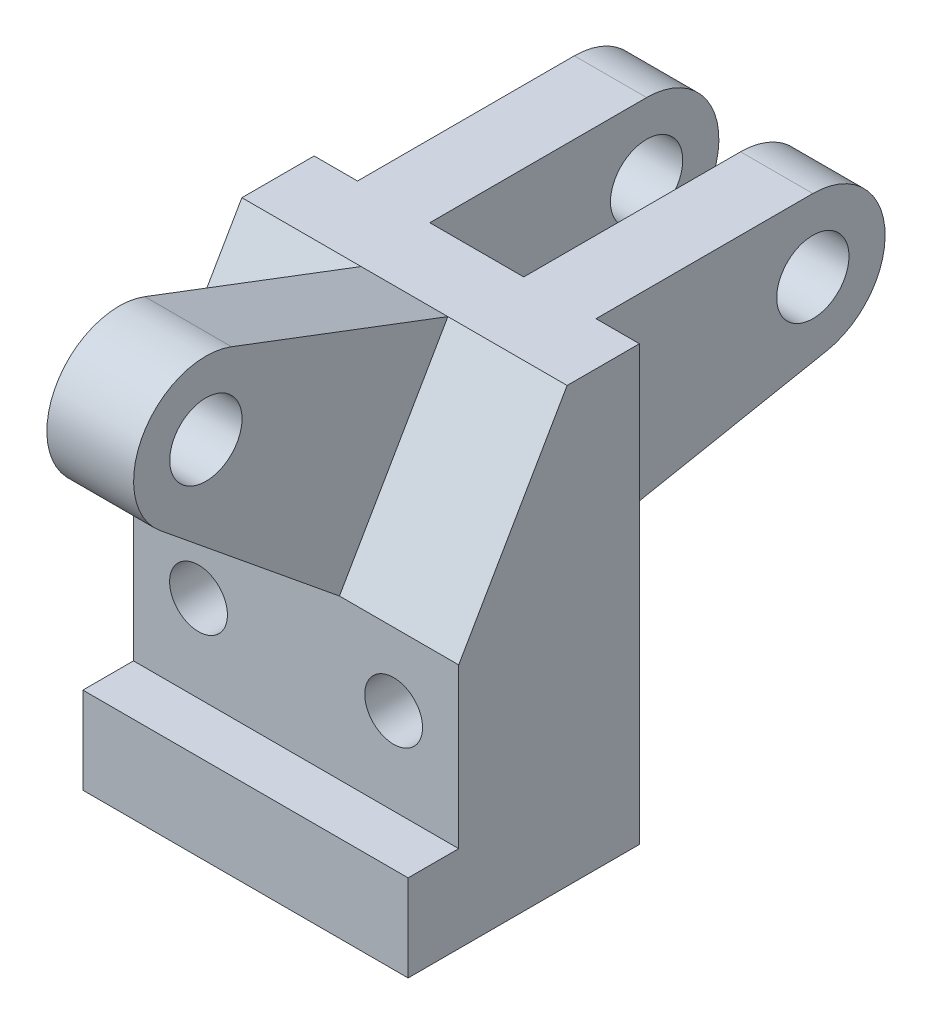
from build123d import *

# Parameters (mm, degrees)
BOSS_EXTRUDE1_DEPTH = 22.5
SKETCH2_R           = 5
BOSS_EXTRUDE2_DEPTH = 16.5
SKETCH3_W           = 13
SKETCH3_H           = 52.478254128
CUT_EXTRUDE1_DEPTH  = 76.539724649
SKETCH4_R           = 5
BOSS_EXTRUDE3_DEPTH = 6
SKETCH5_R           = 4
CUT_EXTRUDE2_DEPTH  = 100.582303751


with BuildPart() as part:
    # Sketch1 → Boss-Extrude1 (new, symmetric)
    with BuildSketch(Plane(origin=(0, 0, 0), x_dir=(0, 0, -1), z_dir=(1, 0, 0))):
        Polygon((0, 60), (0, 0), (-32, 0), (-32, 12), (-25, 12), (-25, 34.019237886), (-10, 60), align=None)
    extrude(amount=BOSS_EXTRUDE1_DEPTH, both=True)

    # Sketch2 → Boss-Extrude2 (add, symmetric)
    with BuildSketch(Plane(origin=(0, 0, 0), x_dir=(0, 0, -1), z_dir=(1, 0, 0))):
        with BuildLine():
            Line((0, 60), (30, 60))
            ThreePointArc((30, 60), (39.954230484, 50.95566494), (31.902581816, 40.182659096))
            Line((31.902581816, 40.182659096), (0, 34))
            Line((0, 34), (0, 60))
        make_face()
        with Locations((30, 50)):
            Circle(SKETCH2_R, mode=Mode.SUBTRACT)
    extrude(amount=BOSS_EXTRUDE2_DEPTH, both=True)

    # Sketch3 → Cut-Extrude1 (cut, through all)
    with BuildSketch(Plane(origin=(0, 60, 0), x_dir=(1, 0, 0), z_dir=(0, 1, 0))):
        with Locations((0, 26.239127064)):
            Rectangle(SKETCH3_W, SKETCH3_H)
    extrude(amount=-CUT_EXTRUDE1_DEPTH, mode=Mode.SUBTRACT)

    # Sketch4 → Boss-Extrude3 (add, symmetric)
    with BuildSketch(Plane(origin=(0, 0, 0), x_dir=(0, 0, -1), z_dir=(1, 0, 0))):
        with BuildLine():
            Line((-10, 60), (-39.932790381, 71.359051898))
            ThreePointArc((-39.932790381, 71.359051898), (-52.141016151, 67.009618943), (-49.803622697, 54.262268813))
            Line((-49.803622697, 54.262268813), (-25, 34.019237886))
            Line((-25, 34.019237886), (-10, 60))
        make_face()
        with Locations((-43.480762114, 62.009618943)):
            Circle(SKETCH4_R, mode=Mode.SUBTRACT)
    extrude(amount=BOSS_EXTRUDE3_DEPTH, both=True)

    # Sketch5 → Cut-Extrude2 (cut, through all)
    with BuildSketch(Plane.XY.offset(25)):
        with Locations((-13.5, 24)):
            Circle(SKETCH5_R)
        with Locations((13.5, 24)):
            Circle(SKETCH5_R)
    extrude(amount=-CUT_EXTRUDE2_DEPTH, mode=Mode.SUBTRACT)


solid = part.part
